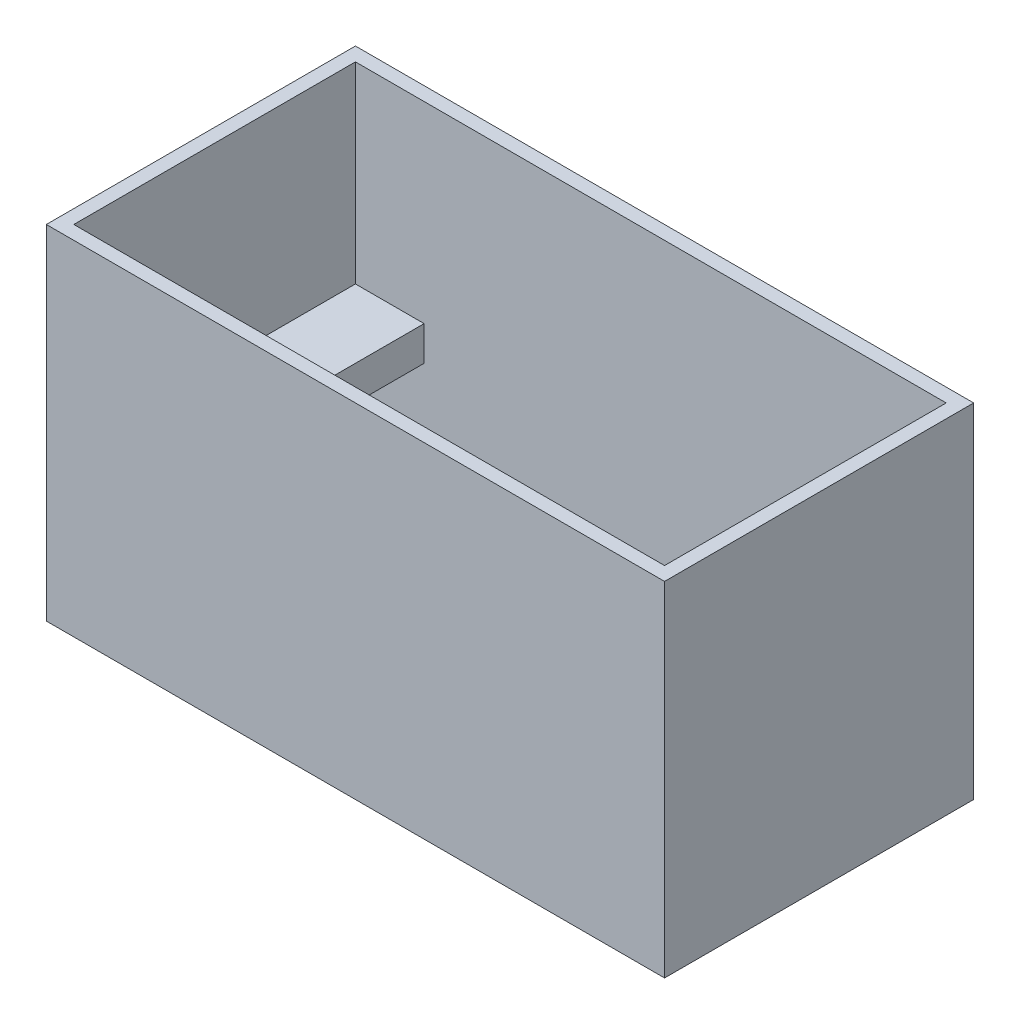
from build123d import *

# Parameters (mm, degrees)
SKETCH1_W           = 90
SKETCH1_H           = 45
BOSS_EXTRUDE1_DEPTH = 50
SHELL1_T            = -2
SKETCH13_W          = 41.406561997
SKETCH13_H          = 5
BOSS_EXTRUDE3_DEPTH = 10
SKETCH15_W          = 41
SKETCH15_H          = 5
BOSS_EXTRUDE4_DEPTH = 10
SKETCH11_W          = 41
SKETCH11_H          = 15
CUT_EXTRUDE1_DEPTH  = 3
SKETCH26_R          = 2.5
BOSS_EXTRUDE5_DEPTH = 10
BOSS_EXTRUDE5_TAPER = 3
SKETCH27_R          = 2.5
BOSS_EXTRUDE6_DEPTH = 10
BOSS_EXTRUDE6_TAPER = 3


with BuildPart() as part:
    # Sketch1 → Boss-Extrude1 (new body)
    with BuildSketch(Plane(origin=(0, 0, 0), x_dir=(1, 0, 0), z_dir=(0, 1, 0))):
        with Locations((4.862356655, 3.4550978)):
            Rectangle(SKETCH1_W, SKETCH1_H)
    extrude(amount=BOSS_EXTRUDE1_DEPTH)

    # Shell1
    shell1_openings = [part.faces().sort_by_distance(p)[0] for p in [
        (4.862356655, 50, -3.4550978),
    ]]
    offset(amount=SHELL1_T, openings=shell1_openings, kind=Kind.INTERSECTION)

    # Sketch13 → Boss-Extrude3 (add)
    with BuildSketch(Plane(origin=(-38.137643345, 0, 0), x_dir=(0, 0, -1), z_dir=(1, 0, 0))):
        with Locations((3.658378798, 19.5)):
            Rectangle(SKETCH13_W, SKETCH13_H)
    extrude(amount=BOSS_EXTRUDE3_DEPTH)

    # Sketch15 → Boss-Extrude4 (add)
    with BuildSketch(Plane.ZY.offset(-47.862356655)):
        with Locations((-3.4550978, 24.5)):
            Rectangle(SKETCH15_W, SKETCH15_H)
    extrude(amount=BOSS_EXTRUDE4_DEPTH)

    # Sketch11 → Cut-Extrude1 (cut)
    with BuildSketch(Plane(origin=(-38.137643345, 0, 0), x_dir=(0, 0, -1), z_dir=(1, 0, 0))):
        with Locations((3.4550978, 9.5)):
            Rectangle(SKETCH11_W, SKETCH11_H)
    extrude(amount=-CUT_EXTRUDE1_DEPTH, mode=Mode.SUBTRACT)

    # Sketch26 → Boss-Extrude5 (add)
    with BuildSketch(Plane(origin=(0, 27, 0), x_dir=(1, 0, 0), z_dir=(0, 1, 0))):
        with Locations((42.895820428, 16.185162885)):
            Circle(SKETCH26_R)
    extrude(amount=BOSS_EXTRUDE5_DEPTH, taper=BOSS_EXTRUDE5_TAPER)

    # Sketch27 → Boss-Extrude6 (add)
    with BuildSketch(Plane(origin=(0, 27, 0), x_dir=(1, 0, 0), z_dir=(0, 1, 0))):
        with Locations((42.882046205, -9.342272768)):
            Circle(SKETCH27_R)
    extrude(amount=BOSS_EXTRUDE6_DEPTH, taper=BOSS_EXTRUDE6_TAPER)


solid = part.part
